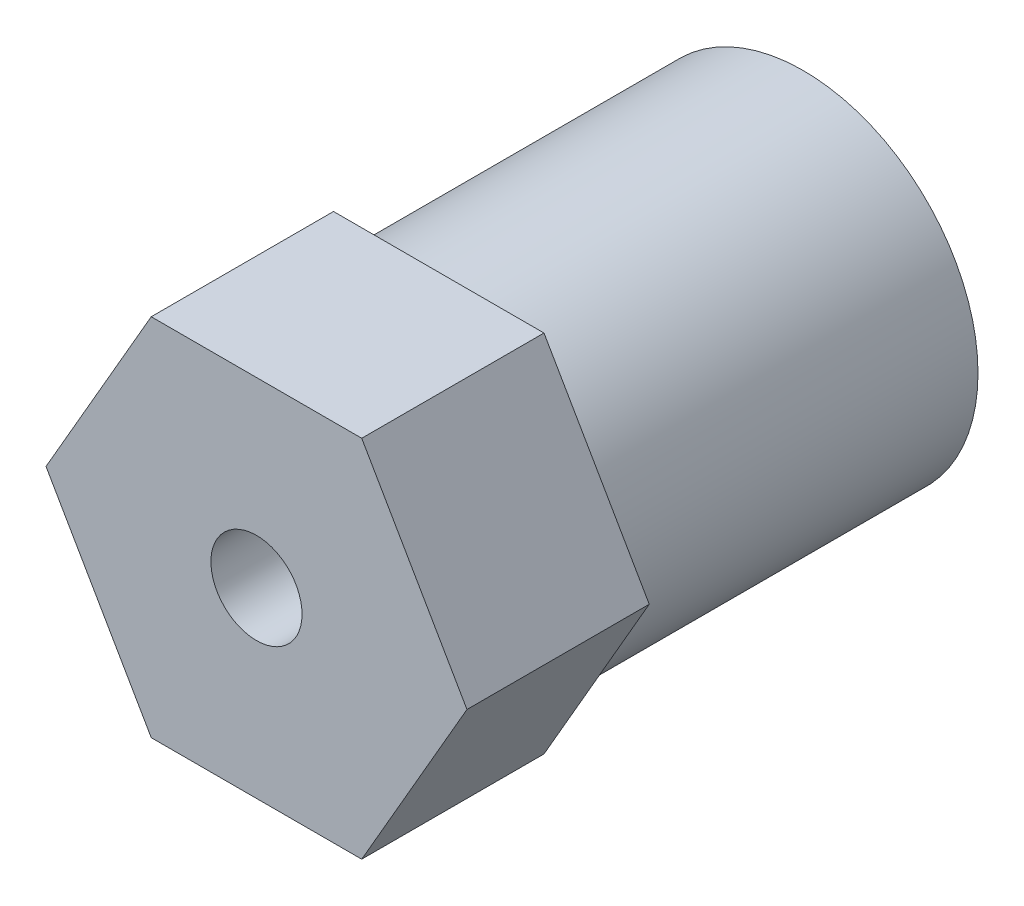
from build123d import *

# Parameters (mm, degrees)
SKETCH1_R           = 5.75
SKETCH1_R_2         = 3
BOSS_EXTRUDE1_DEPTH = 12
BOSS_EXTRUDE2_DEPTH = 6
SKETCH3_R           = 1.5
CUT_EXTRUDE1_DEPTH  = 21.199009877


with BuildPart() as part:
    # Sketch1 → Boss-Extrude1 (new body)
    with BuildSketch(Plane.XY):
        Circle(SKETCH1_R)
        Circle(SKETCH1_R_2, mode=Mode.SUBTRACT)
    extrude(amount=BOSS_EXTRUDE1_DEPTH)

    # Sketch2 → Boss-Extrude2 (add)
    with BuildSketch(Plane.XY.offset(12)):
        Polygon((3.464101615, -6), (6.92820323, 0), (3.464101615, 6), (-3.464101615, 6), (-6.92820323, 0), (-3.464101615, -6), align=None)
    extrude(amount=BOSS_EXTRUDE2_DEPTH)

    # Sketch3 → Cut-Extrude1 (cut, through all)
    with BuildSketch(Plane.XY.offset(18)):
        Circle(SKETCH3_R)
    extrude(amount=-CUT_EXTRUDE1_DEPTH, mode=Mode.SUBTRACT)


solid = part.part
